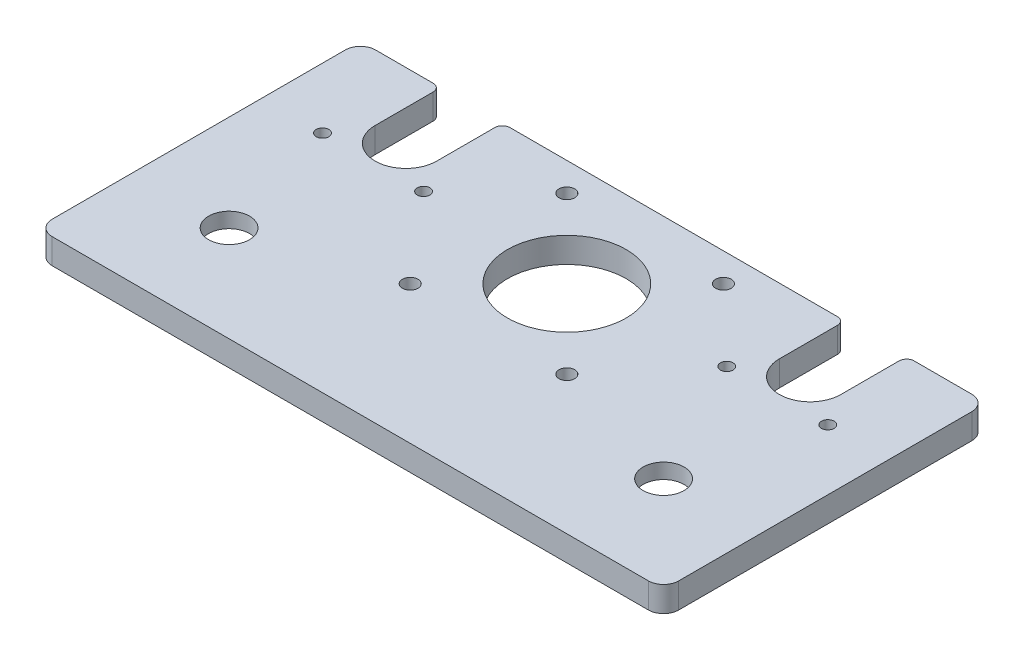
from build123d import *

# Parameters (mm, degrees)
SKETCH1_W           = 124
SKETCH1_H           = 64
BOSS_EXTRUDE1_DEPTH = 5
CUT_EXTRUDE1_DEPTH  = 5
SKETCH3_W           = 30.202540726
SKETCH3_H           = 30.202540726
CUT_EXTRUDE2_DEPTH  = 2
SKETCH4_R           = 2
CUT_EXTRUDE3_DEPTH  = 2
SKETCH5_R           = 4.05
SKETCH5_R_2         = 1.55
SKETCH5_R_3         = 11.75
CUT_EXTRUDE4_DEPTH  = 5
SKETCH6_R           = 1.25
CUT_EXTRUDE5_DEPTH  = 10
FILLET1_R           = 3
FILLET2_R           = 1.5


with BuildPart() as part:
    # Sketch1 → Boss-Extrude1 (new body)
    with BuildSketch(Plane(origin=(0, 0, 0), x_dir=(1, 0, 0), z_dir=(0, 1, 0))):
        with Locations((62, -32)):
            Rectangle(SKETCH1_W, SKETCH1_H)
    extrude(amount=BOSS_EXTRUDE1_DEPTH)

    # Sketch2 → Cut-Extrude1 (cut)
    with BuildSketch(Plane(origin=(0, 5, 0), x_dir=(1, 0, 0), z_dir=(0, 1, 0))):
        with BuildLine():
            Line((15.897459274, -12.997459274), (15.897459274, 12.365379101))
            Line((15.897459274, 12.365379101), (28.097459274, 12.365379101))
            Line((28.097459274, 12.365379101), (28.097459274, -12.997459274))
            ThreePointArc((28.097459274, -12.997459274), (21.997459274, -19.097459274), (15.897459274, -12.997459274))
        make_face()
        with BuildLine():
            Line((95.902540726, 12.365379101), (95.902540726, -12.997459274))
            ThreePointArc((95.902540726, -12.997459274), (102.002540726, -19.097459274), (108.102540726, -12.997459274))
            Line((108.102540726, -12.997459274), (108.102540726, 12.365379101))
            Line((108.102540726, 12.365379101), (95.902540726, 12.365379101))
        make_face()
    extrude(amount=-CUT_EXTRUDE1_DEPTH, mode=Mode.SUBTRACT)

    # Sketch3 → Cut-Extrude2 (cut)
    with BuildSketch(Plane.XZ):
        with Locations((18.998729637, 44.998729637)):
            Rectangle(SKETCH3_W, SKETCH3_H)
        with Locations((105.001270363, 44.998729637)):
            Rectangle(SKETCH3_W, SKETCH3_H)
    extrude(amount=-CUT_EXTRUDE2_DEPTH, mode=Mode.SUBTRACT)

    # Sketch4 → Cut-Extrude3 (cut)
    with BuildSketch(Plane.XZ):
        with Locations((34.1, 29.897459274)):
            Circle(SKETCH4_R)
        with Locations((34.1, 60.1)):
            Circle(SKETCH4_R)
        with Locations((3.897459274, 60.1)):
            Circle(SKETCH4_R)
        with Locations((3.897459274, 29.897459274)):
            Circle(SKETCH4_R)
        with Locations((120.102540726, 29.897459274)):
            Circle(SKETCH4_R)
        with Locations((120.102540726, 60.1)):
            Circle(SKETCH4_R)
        with Locations((89.9, 60.1)):
            Circle(SKETCH4_R)
        with Locations((89.9, 29.897459274)):
            Circle(SKETCH4_R)
    extrude(amount=-CUT_EXTRUDE3_DEPTH, mode=Mode.SUBTRACT)

    # Sketch5 → Cut-Extrude4 (cut)
    with BuildSketch(Plane.XZ):
        with Locations(Location((18.998729637, 44.998729637, 0), (0, 0, 270))):
            Circle(SKETCH5_R)
        with Locations(Location((105.001270363, 44.998729637, 0), (0, 0, 270))):
            Circle(SKETCH5_R)
        with Locations(Location((77.5, 36.648702719, 0), (0, 0, 270))):
            Circle(SKETCH5_R_2)
        with Locations(Location((46.5, 36.648702719, 0), (0, 0, 270))):
            Circle(SKETCH5_R_2)
        with Locations(Location((46.5, 5.648702719, 0), (0, 0, 270))):
            Circle(SKETCH5_R_2)
        with Locations(Location((77.5, 5.648702719, 0), (0, 0, 270))):
            Circle(SKETCH5_R_2)
        with Locations(Location((62, 21.148702719, 0), (0, 0, 270))):
            Circle(SKETCH5_R_3)
    extrude(amount=-CUT_EXTRUDE4_DEPTH, mode=Mode.SUBTRACT)

    # Sketch6 → Cut-Extrude5 (cut)
    with BuildSketch(Plane(origin=(0, 5, 0), x_dir=(1, 0, 0), z_dir=(0, 1, 0))):
        with Locations(Location((11.997459274, -19.497459274, 0), (0, 0, 270))):
            Circle(SKETCH6_R)
        with Locations(Location((31.997459274, -19.497459274, 0), (0, 0, 270))):
            Circle(SKETCH6_R)
        with Locations(Location((92.002540726, -19.497459274, 0), (0, 0, 270))):
            Circle(SKETCH6_R)
        with Locations(Location((112.002540726, -19.497459274, 0), (0, 0, 270))):
            Circle(SKETCH6_R)
    extrude(amount=-CUT_EXTRUDE5_DEPTH, mode=Mode.SUBTRACT)

    # Fillet1
    fillet1_edges = [part.edges().sort_by_distance(p)[0] for p in [
        (0, 2.5, 0),
        (124, 2.5, 0),
        (124, 2.5, 64),
        (0, 2.5, 64),
    ]]
    fillet(fillet1_edges, radius=FILLET1_R)

    # Fillet2
    fillet2_edges = [part.edges().sort_by_distance(p)[0] for p in [
        (15.897459274, 2.5, 0),
        (28.097459274, 2.5, 0),
        (95.902540726, 2.5, 0),
        (108.102540726, 2.5, 0),
    ]]
    fillet(fillet2_edges, radius=FILLET2_R)


solid = part.part
